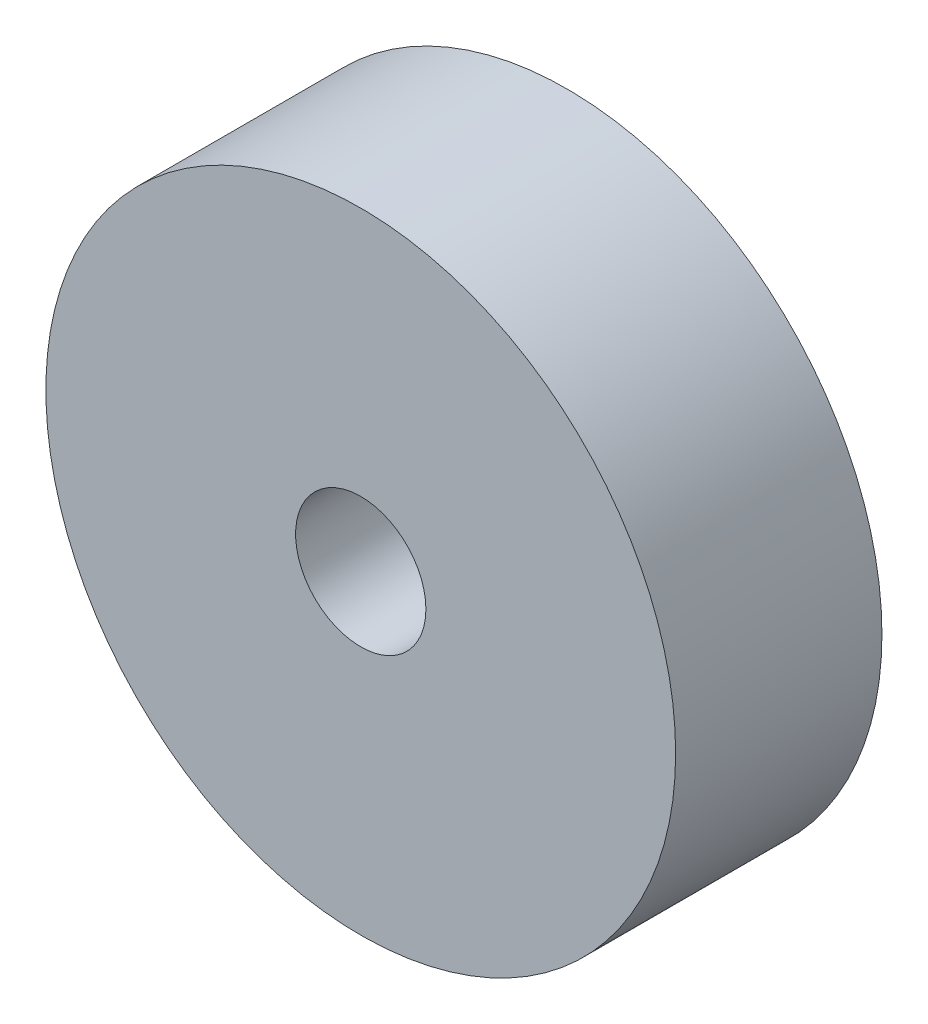
from build123d import *

# Parameters (mm, degrees)
SKETCH1_R           = 29
BOSS_EXTRUDE1_DEPTH = 19
SKETCH2_R           = 6
CUT_EXTRUDE1_DEPTH  = 19


with BuildPart() as part:
    # Sketch1 → Boss-Extrude1 (new body)
    with BuildSketch(Plane.XY):
        Circle(SKETCH1_R)
    extrude(amount=BOSS_EXTRUDE1_DEPTH)

    # Sketch2 → Cut-Extrude1 (cut)
    with BuildSketch(Plane.XY.offset(19)):
        Circle(SKETCH2_R)
    extrude(amount=-CUT_EXTRUDE1_DEPTH, mode=Mode.SUBTRACT)


solid = part.part
